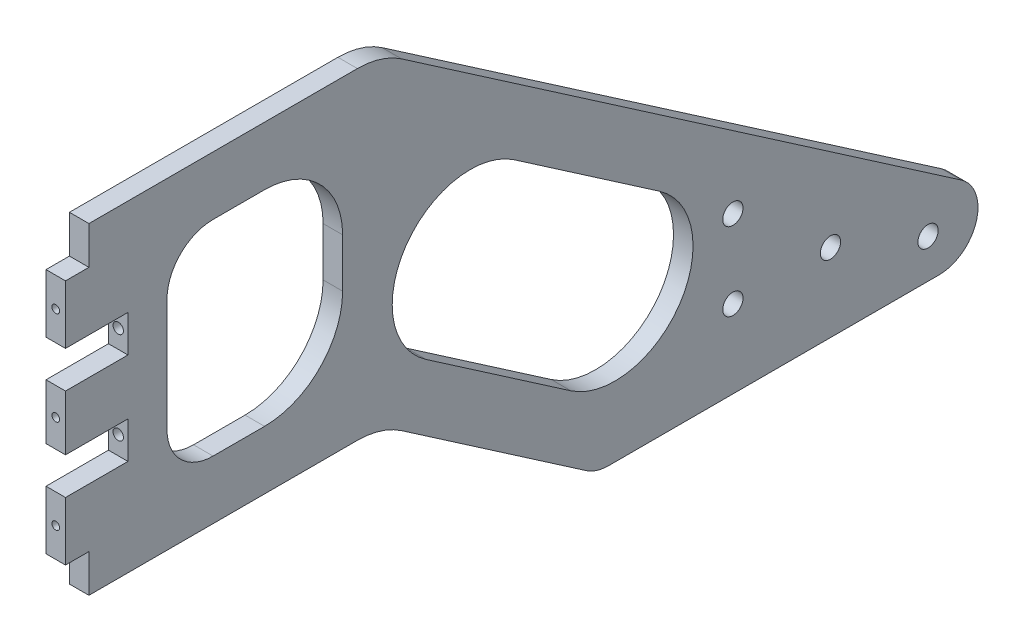
from build123d import *

# Parameters (mm, degrees)
SKETCH1_W                 = 7.62
SKETCH1_H                 = 19.05
SKETCH1_H_2               = 18
BOSS_EXTRUDE1_DEPTH       = 6.35
FILLET1_R                 = 25.4
FILLET2_R                 = 12.7
M6_CLEARANCE_HOLE1_D      = 6.6
M3_CLEARANCE_HOLE1_D      = 3.4
M3_CLEARANCE_HOLE1_DEPTH  = 12.7
FILLET4_R                 = 15
M3X0_5_TAPPED_HOLE1_D     = 2.5
M3X0_5_TAPPED_HOLE1_DEPTH = 25.4
M3X0_5_TAPPED_HOLE1_TIP   = 0.751075774


with BuildPart() as part:
    # Sketch1 → Boss-Extrude1 (new body)
    with BuildSketch(Plane(origin=(0, 0, 0), x_dir=(0, 0, -1), z_dir=(1, 0, 0))):
        with BuildLine():
            Line((-28.329731999, 0), (124.070268001, 0))
            Line((124.070268001, 0), (-28.329731999, 104.775))
            Line((-28.329731999, 104.775), (-28.329731999, 83.211174444))
            Line((-28.329731999, 83.211174444), (-7.855401914, 69.135072511))
            ThreePointArc((-7.855401914, 69.135072511), (0.925492913, 37.798764283), (-28.329731999, 23.543935534))
            Line((-28.329731999, 23.543935534), (-28.329731999, 0))
        make_face()
        with BuildLine():
            Line((-28.329731999, 83.211174444), (-28.329731999, 104.775))
            Line((-28.329731999, 104.775), (-63.254731999, 128.7859375))
            Line((-63.254731999, 128.7859375), (-63.254731999, 105.242001966))
            ThreePointArc((-63.254731999, 105.242001966), (-58.93358663, 103.752256793), (-54.949397882, 101.512194739))
            Line((-54.949397882, 101.512194739), (-28.329731999, 83.211174444))
        make_face()
        with BuildLine():
            Line((-63.254731999, 105.242001966), (-63.254731999, 128.7859375))
            Line((-63.254731999, 128.7859375), (-98.179731999, 152.796875))
            Line((-98.179731999, 152.796875), (-98.179731999, 100.409375))
            Line((-98.179731999, 100.409375), (-90.269894858, 94.971361965))
            ThreePointArc((-90.269894858, 94.971361965), (-78.365507142, 104.323608978), (-63.254731999, 105.242001966))
        make_face()
        with BuildLine():
            Line((-98.179731999, 48.021875), (-63.254731999, 24.0109375))
            Line((-63.254731999, 24.0109375), (-63.254731999, 45.574763056))
            Line((-63.254731999, 45.574763056), (-83.729062085, 59.650864989))
            ThreePointArc((-83.729062085, 59.650864989), (-94.31459291, 75.956462655), (-90.269894858, 94.971361965))
            Line((-90.269894858, 94.971361965), (-98.179731999, 100.409375))
            Line((-98.179731999, 100.409375), (-98.179731999, 48.021875))
        make_face()
        with BuildLine():
            Line((-63.254731999, 24.0109375), (-28.329731999, 0))
            Line((-28.329731999, 0), (-28.329731999, 23.543935534))
            ThreePointArc((-28.329731999, 23.543935534), (-32.650877369, 25.033680707), (-36.635066117, 27.273742761))
            Line((-36.635066117, 27.273742761), (-63.254731999, 45.574763056))
            Line((-63.254731999, 45.574763056), (-63.254731999, 24.0109375))
        make_face()
        Polygon((-139.454731999, 48.021875), (-98.179731999, 48.021875), (-98.179731999, 100.409375), (-98.179731999, 152.796875), (-139.454731999, 152.796875), (-139.454731999, 133.746875), (-110.879731999, 133.746875), (-110.879731999, 67.071875), (-139.454731999, 67.071875), align=None)
        Polygon((-180.729731999, 48.021875), (-139.454731999, 48.021875), (-139.454731999, 67.071875), (-168.029731999, 67.071875), (-168.029731999, 133.746875), (-139.454731999, 133.746875), (-139.454731999, 152.796875), (-180.729731999, 152.796875), (-180.729731999, 121.409375), (-180.729731999, 109.409375), (-180.729731999, 100.409375), (-180.729731999, 91.409375), (-180.729731999, 79.409375), align=None)
        Polygon((-180.729731999, 121.409375), (-180.729731999, 152.796875), (-193.429731999, 152.796875), (-193.429731999, 140.459375), (-193.429731999, 121.409375), align=None)
        with Locations((-197.239731999, 130.934375)):
            Rectangle(SKETCH1_W, SKETCH1_H)
        Polygon((-193.429731999, 91.409375), (-180.729731999, 91.409375), (-180.729731999, 100.409375), (-180.729731999, 109.409375), (-193.429731999, 109.409375), align=None)
        with Locations((-197.239731999, 100.409375)):
            Rectangle(SKETCH1_W, SKETCH1_H_2)
        with Locations((-197.239731999, 69.884375)):
            Rectangle(SKETCH1_W, SKETCH1_H)
        Polygon((-193.429731999, 48.021875), (-180.729731999, 48.021875), (-180.729731999, 79.409375), (-193.429731999, 79.409375), (-193.429731999, 60.359375), align=None)
    extrude(amount=BOSS_EXTRUDE1_DEPTH)

    # Fillet1
    fillet1_edges = [part.edges().sort_by_distance(p)[0] for p in [
        (3.175, 67.071875, 110.879731999),
        (3.175, 133.746875, 110.879731999),
        (3.175, 152.796875, 98.179731999),
        (3.175, 48.021875, 98.179731999),
    ]]
    fillet(fillet1_edges, radius=FILLET1_R)

    # Fillet2
    fillet2_edges = [part.edges().sort_by_distance(p)[0] for p in [
        (3.175, 0, -124.070268001),
        (3.175, 0, 28.329731999),
    ]]
    fillet(fillet2_edges, radius=FILLET2_R)

    # M6 Clearance Hole1 (through all)
    with Locations(Plane(origin=(6.35, 0, 0), x_dir=(0, 0, -1), z_dir=(1, 0, 0))):
        with Locations((16.120268001, 25.4), (47.870268001, 25.4), (79.620268001, 12.7), (16.120268001, 50.8)):
            Hole(M6_CLEARANCE_HOLE1_D / 2)

    # M3 Clearance Hole1
    with Locations(Plane.XY.offset(180.729731999)):
        with Locations((3.175, 85.409375), (3.175, 115.409375)):
            Hole(M3_CLEARANCE_HOLE1_D / 2, depth=M3_CLEARANCE_HOLE1_DEPTH)

    # Fillet4
    fillet4_edges = [part.edges().sort_by_distance(p)[0] for p in [
        (3.175, 133.746875, 168.029731999),
        (3.175, 67.071875, 168.029731999),
    ]]
    fillet(fillet4_edges, radius=FILLET4_R)

    # M3x0.5 Tapped Hole1
    with Locations(Plane.XY.offset(201.049731999)):
        with Locations((3.175, 69.884375), (3.175, 130.934375), (3.175, 100.409375)):
            Hole(M3X0_5_TAPPED_HOLE1_D / 2, depth=M3X0_5_TAPPED_HOLE1_DEPTH)
            with Locations((0, 0, -(M3X0_5_TAPPED_HOLE1_DEPTH + M3X0_5_TAPPED_HOLE1_TIP / 2))):  # 118° drill point
                Cone(0, M3X0_5_TAPPED_HOLE1_D / 2, M3X0_5_TAPPED_HOLE1_TIP, mode=Mode.SUBTRACT)


solid = part.part
